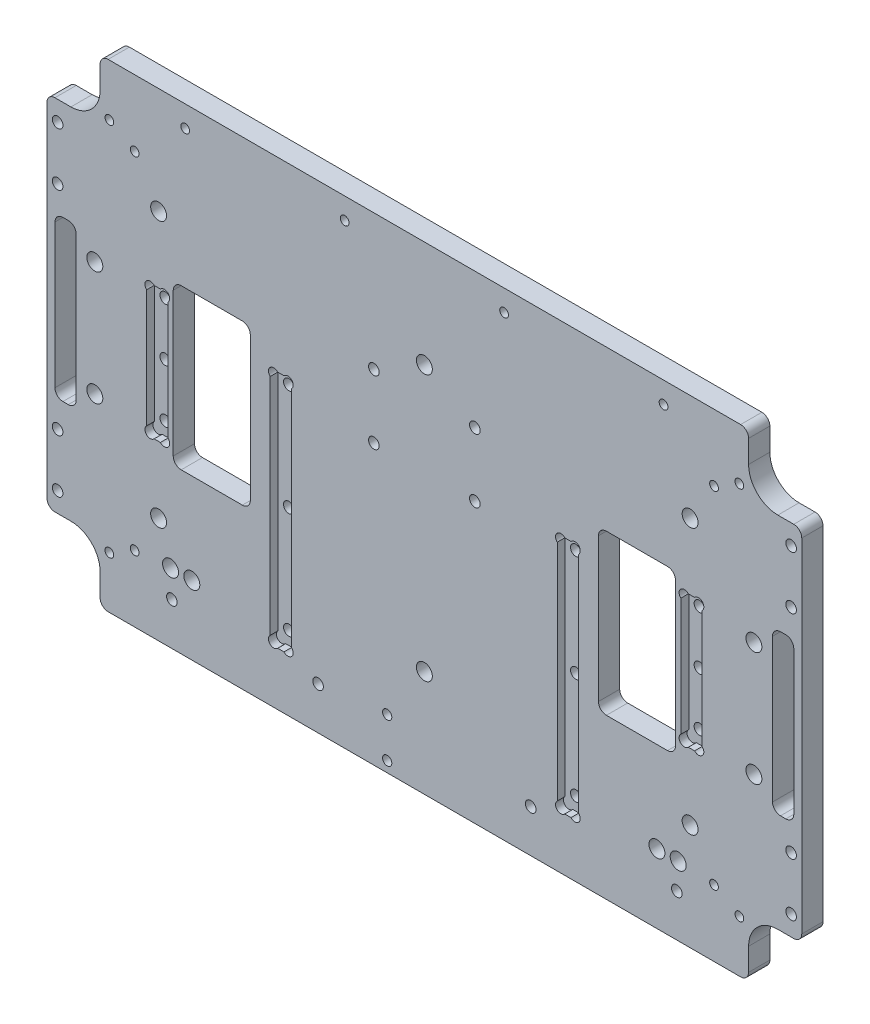
from build123d import *

# Parameters (mm, degrees)
ESQUISSE1_W                  = 284
ESQUISSE1_H                  = 180
BOSS_EXTRU_1_DEPTH           = 8
ESQUISSE2_W                  = 29
ESQUISSE2_H                  = 60
ESQUISSE2_W_2                = 8
ENL_V_MAT_EXTRU_1_DEPTH      = 337.333168153
ESQUISSE3_R                  = 1.65
ENL_V_MAT_EXTRU_2_DEPTH      = 8
ESQUISSE4_W                  = 8
ESQUISSE4_H                  = 90
ESQUISSE4_H_2                = 50
ENL_V_MAT_EXTRU_3_DEPTH      = 3
ESQUISSE5_R                  = 2
ENL_V_MAT_EXTRU_4_DEPTH      = 337.333168153
ESQUISSE6_R                  = 3
ENL_V_MAT_EXTRU_5_DEPTH      = 337.333168153
ESQUISSE8_W                  = 20
ESQUISSE8_H                  = 22.5
ENL_V_MAT_EXTRU_7_DEPTH      = 337.333168153
CONG_1_R                     = 11
ESQUISSE7_R                  = 1.65
ENL_V_MAT_EXTRU_6_DEPTH      = 337.333168153
CONG_2_R                     = 3
ESQUISSE9_R                  = 2
ENL_V_MAT_EXTRU_8_DEPTH      = 3
CONG_3_R                     = 3
ESQUISSE10_R                 = 2
ENL_V_MAT_EXTRU_9_DEPTH      = 337.27518493
ESQUISSE11_R                 = 2
ESQUISSE11_R_2               = 3
ENL_V_MAT_EXTRU_10_DEPTH     = 337.333168153
ESQUISSE12_R                 = 1.75
ENL_V_MAT_EXTRU_11_DEPTH     = 337.333168153
ESQUISSE13_R                 = 2
ENL_V_MAT_EXTRU_12_DEPTH     = 337.333168153
FIXATIONS_USINAGE_DEPTH      = 337.333168153
FIXATIONS_USINAGE_DEPTH_BACK = 337.333168153
ESQUISSE14_R                 = 3


with BuildPart() as part:
    # Esquisse1 → Boss.-Extru.1 (new body)
    with BuildSketch(Plane.XY):
        with Locations((142, 90)):
            Rectangle(ESQUISSE1_W, ESQUISSE1_H)
    extrude(amount=BOSS_EXTRU_1_DEPTH)

    # Esquisse2 → Enlèv. mat.-Extru.1 (cut, through all)
    with BuildSketch(Plane.XY.offset(8)):
        with Locations((62, 90)):
            Rectangle(ESQUISSE2_W, ESQUISSE2_H)
        with Locations((7, 90)):
            Rectangle(ESQUISSE2_W_2, ESQUISSE2_H)
        with Locations((277, 90)):
            Rectangle(ESQUISSE2_W_2, ESQUISSE2_H)
        with Locations((222, 90)):
            Rectangle(ESQUISSE2_W, ESQUISSE2_H)
    extrude(amount=-ENL_V_MAT_EXTRU_1_DEPTH, mode=Mode.SUBTRACT)

    # Esquisse3 → Enlèv. mat.-Extru.2 (cut)
    with BuildSketch(Plane.XY.offset(8)):
        with Locations((112, 172)):
            Circle(ESQUISSE3_R)
        with Locations((172, 172)):
            Circle(ESQUISSE3_R)
        with Locations((232, 172)):
            Circle(ESQUISSE3_R)
        with Locations((52, 172)):
            Circle(ESQUISSE3_R)
    extrude(amount=-ENL_V_MAT_EXTRU_2_DEPTH, mode=Mode.SUBTRACT)

    # Esquisse4 → Enlèv. mat.-Extru.3 (cut)
    with BuildSketch(Plane.XY.offset(8)):
        with Locations((88, 65)):
            Rectangle(ESQUISSE4_W, ESQUISSE4_H)
        with Locations((196, 65)):
            Rectangle(ESQUISSE4_W, ESQUISSE4_H)
        with Locations((41.5, 90)):
            Rectangle(ESQUISSE4_W, ESQUISSE4_H_2)
        with Locations((242.5, 90)):
            Rectangle(ESQUISSE4_W, ESQUISSE4_H_2)
    extrude(amount=-ENL_V_MAT_EXTRU_3_DEPTH, mode=Mode.SUBTRACT)

    # Esquisse5 → Enlèv. mat.-Extru.4 (cut, through all)
    with BuildSketch(Plane.XY.offset(8)):
        with Locations((123, 129)):
            Circle(ESQUISSE5_R)
        with Locations(Location((123, 105, 0), (0, 0, 180))):
            Circle(ESQUISSE5_R)
        with Locations((161, 105)):
            Circle(ESQUISSE5_R)
        with Locations(Location((161, 129, 0), (0, 0, 180))):
            Circle(ESQUISSE5_R)
    extrude(amount=-ENL_V_MAT_EXTRU_4_DEPTH, mode=Mode.SUBTRACT)

    # Esquisse6 → Enlèv. mat.-Extru.5 (cut, through all)
    with BuildSketch(Plane.XY.offset(8)):
        with Locations((18, 111.5)):
            Circle(ESQUISSE6_R)
        with Locations(Location((18, 68.5, 0), (0, 0, 180))):
            Circle(ESQUISSE6_R)
        with Locations((266, 68.5)):
            Circle(ESQUISSE6_R)
        with Locations(Location((266, 111.5, 0), (0, 0, 180))):
            Circle(ESQUISSE6_R)
    extrude(amount=-ENL_V_MAT_EXTRU_5_DEPTH, mode=Mode.SUBTRACT)

    # Esquisse8 → Enlèv. mat.-Extru.7 (cut, through all)
    with BuildSketch(Plane.XY.offset(8)):
        with Locations((10, 168.75)):
            Rectangle(ESQUISSE8_W, ESQUISSE8_H)
        with Locations((274, 168.75)):
            Rectangle(ESQUISSE8_W, ESQUISSE8_H)
        with Locations((274, 11.25)):
            Rectangle(ESQUISSE8_W, ESQUISSE8_H)
        with Locations((10, 11.25)):
            Rectangle(ESQUISSE8_W, ESQUISSE8_H)
    extrude(amount=-ENL_V_MAT_EXTRU_7_DEPTH, mode=Mode.SUBTRACT)

    # Congé1
    cong_1_edges = [part.edges().sort_by_distance(p)[0] for p in [
        (20, 157.5, 4),
        (264, 157.5, 4),
        (20, 22.5, 4),
        (264, 22.5, 4),
    ]]
    fillet(cong_1_edges, radius=CONG_1_R)

    # Esquisse7 → Enlèv. mat.-Extru.6 (cut, through all)
    with BuildSketch(Plane.XY.offset(8)):
        with Locations((33, 155)):
            Circle(ESQUISSE7_R)
        with Locations((23.473720558, 160.5)):
            Circle(ESQUISSE7_R)
        with Locations(Location((260.526279442, 160.5, 0), (0, 0, 180))):
            Circle(ESQUISSE7_R)
        with Locations(Location((251, 155, 0), (0, 0, 180))):
            Circle(ESQUISSE7_R)
        with Locations(Location((23.473720558, 19.5, 0), (0, 0, 180))):
            Circle(ESQUISSE7_R)
        with Locations(Location((33, 25, 0), (0, 0, 180))):
            Circle(ESQUISSE7_R)
        with Locations((251, 25)):
            Circle(ESQUISSE7_R)
        with Locations((260.526279442, 19.5)):
            Circle(ESQUISSE7_R)
    extrude(amount=-ENL_V_MAT_EXTRU_6_DEPTH, mode=Mode.SUBTRACT)

    # Congé2
    cong_2_edges = [part.edges().sort_by_distance(p)[0] for p in [
        (47.5, 60, 4),
        (47.5, 120, 4),
        (76.5, 120, 4),
        (76.5, 60, 4),
        (3, 60, 4),
        (3, 120, 4),
        (11, 120, 4),
        (11, 60, 4),
        (281, 60, 4),
        (273, 60, 4),
        (273, 120, 4),
        (281, 120, 4),
        (236.5, 60, 4),
        (207.5, 60, 4),
        (207.5, 120, 4),
        (236.5, 120, 4),
    ]]
    fillet(cong_2_edges, radius=CONG_2_R)

    # Esquisse9 → Enlèv. mat.-Extru.8 (cut)
    with BuildSketch(Plane.XY.offset(8)):
        with Locations((38.843502884, 113.656497116)):
            Circle(ESQUISSE9_R)
        with Locations((44.156497116, 113.656497116)):
            Circle(ESQUISSE9_R)
        with Locations((44.156497116, 66.343502884)):
            Circle(ESQUISSE9_R)
        with Locations((38.843502884, 66.343502884)):
            Circle(ESQUISSE9_R)
        with Locations((245.156497116, 66.343502884)):
            Circle(ESQUISSE9_R)
        with Locations((239.843502884, 66.343502884)):
            Circle(ESQUISSE9_R)
        with Locations((239.843502884, 113.656497116)):
            Circle(ESQUISSE9_R)
        with Locations((245.156497116, 113.656497116)):
            Circle(ESQUISSE9_R)
        with Locations((85.343502884, 108.656497116)):
            Circle(ESQUISSE9_R)
        with Locations((90.656497116, 108.656497116)):
            Circle(ESQUISSE9_R)
        with Locations((90.656497116, 21.343502884)):
            Circle(ESQUISSE9_R)
        with Locations((85.343502884, 21.343502884)):
            Circle(ESQUISSE9_R)
        with Locations((198.656497116, 21.343502884)):
            Circle(ESQUISSE9_R)
        with Locations((193.343502884, 21.343502884)):
            Circle(ESQUISSE9_R)
        with Locations((193.343502884, 108.656497116)):
            Circle(ESQUISSE9_R)
        with Locations((198.656497116, 108.656497116)):
            Circle(ESQUISSE9_R)
    extrude(amount=-ENL_V_MAT_EXTRU_8_DEPTH, mode=Mode.SUBTRACT)

    # Congé3
    cong_3_edges = [part.edges().sort_by_distance(p)[0] for p in [
        (0, 157.5, 4),
        (20, 180, 4),
        (264, 180, 4),
        (284, 157.5, 4),
        (0, 22.5, 4),
        (20, 0, 4),
        (264, 0, 4),
        (284, 22.5, 4),
    ]]
    fillet(cong_3_edges, radius=CONG_3_R)

    # Esquisse10 → Enlèv. mat.-Extru.9 (cut, through all)
    with BuildSketch(Plane.XY.offset(5)):
        with Locations((41.5, 90)):
            Circle(ESQUISSE10_R)
        with Locations((41.5, 70)):
            Circle(ESQUISSE10_R)
        with Locations(Location((41.5, 110, 0), (0, 0, 180))):
            Circle(ESQUISSE10_R)
        with Locations((88, 65)):
            Circle(ESQUISSE10_R)
        with Locations((88, 25)):
            Circle(ESQUISSE10_R)
        with Locations(Location((88, 105, 0), (0, 0, 180))):
            Circle(ESQUISSE10_R)
        with Locations((196, 105)):
            Circle(ESQUISSE10_R)
        with Locations(Location((196, 25, 0), (0, 0, 180))):
            Circle(ESQUISSE10_R)
        with Locations(Location((196, 65, 0), (0, 0, 180))):
            Circle(ESQUISSE10_R)
        with Locations((242.5, 110)):
            Circle(ESQUISSE10_R)
        with Locations(Location((242.5, 70, 0), (0, 0, 180))):
            Circle(ESQUISSE10_R)
        with Locations(Location((242.5, 90, 0), (0, 0, 180))):
            Circle(ESQUISSE10_R)
    extrude(amount=-ENL_V_MAT_EXTRU_9_DEPTH, mode=Mode.SUBTRACT)

    # Esquisse11 → Enlèv. mat.-Extru.10 (cut, through all)
    with BuildSketch(Plane.XY.offset(8)):
        with Locations((47, 16)):
            Circle(ESQUISSE11_R)
        with Locations(Location((237, 16, 0), (0, 0, 180))):
            Circle(ESQUISSE11_R)
        with Locations((102, 16)):
            Circle(ESQUISSE11_R)
        with Locations((46.5, 26)):
            Circle(ESQUISSE11_R_2)
        with Locations((54.5, 26)):
            Circle(ESQUISSE11_R_2)
        with Locations(Location((229.5, 26, 0), (0, 0, 180))):
            Circle(ESQUISSE11_R_2)
        with Locations(Location((237.5, 26, 0), (0, 0, 180))):
            Circle(ESQUISSE11_R_2)
        with Locations(Location((182, 16, 0), (0, 0, 180))):
            Circle(ESQUISSE11_R)
    extrude(amount=-ENL_V_MAT_EXTRU_10_DEPTH, mode=Mode.SUBTRACT)

    # Esquisse12 → Enlèv. mat.-Extru.11 (cut, through all)
    with BuildSketch(Plane.XY.offset(8)):
        with Locations((128, 4)):
            Circle(ESQUISSE12_R)
        with Locations((128, 19)):
            Circle(ESQUISSE12_R)
    extrude(amount=-ENL_V_MAT_EXTRU_11_DEPTH, mode=Mode.SUBTRACT)

    # Esquisse13 → Enlèv. mat.-Extru.12 (cut, through all)
    with BuildSketch(Plane.XY.offset(8)):
        with Locations((4, 30)):
            Circle(ESQUISSE13_R)
        with Locations((4, 50)):
            Circle(ESQUISSE13_R)
        with Locations(Location((4, 130, 0), (0, 0, 180))):
            Circle(ESQUISSE13_R)
        with Locations(Location((4, 150, 0), (0, 0, 180))):
            Circle(ESQUISSE13_R)
        with Locations((280, 150)):
            Circle(ESQUISSE13_R)
        with Locations((280, 130)):
            Circle(ESQUISSE13_R)
        with Locations(Location((280, 50, 0), (0, 0, 180))):
            Circle(ESQUISSE13_R)
        with Locations(Location((280, 30, 0), (0, 0, 180))):
            Circle(ESQUISSE13_R)
    extrude(amount=-ENL_V_MAT_EXTRU_12_DEPTH, mode=Mode.SUBTRACT)

    # Esquisse14 → fixations_usinage (cut, two sides: drawn at the far end of the back side and taken through both)
    with BuildSketch(Plane.XY.offset(8).offset(-FIXATIONS_USINAGE_DEPTH_BACK)):
        with Locations((42, 140)):
            Circle(ESQUISSE14_R)
        with Locations(Location((42, 40, 0), (0, 0, 180))):
            Circle(ESQUISSE14_R)
        with Locations((242, 40)):
            Circle(ESQUISSE14_R)
        with Locations(Location((242, 140, 0), (0, 0, 180))):
            Circle(ESQUISSE14_R)
        with Locations((142, 40)):
            Circle(ESQUISSE14_R)
        with Locations(Location((142, 140, 0), (0, 0, 180))):
            Circle(ESQUISSE14_R)
    extrude(amount=FIXATIONS_USINAGE_DEPTH + FIXATIONS_USINAGE_DEPTH_BACK, mode=Mode.SUBTRACT)


solid = part.part
